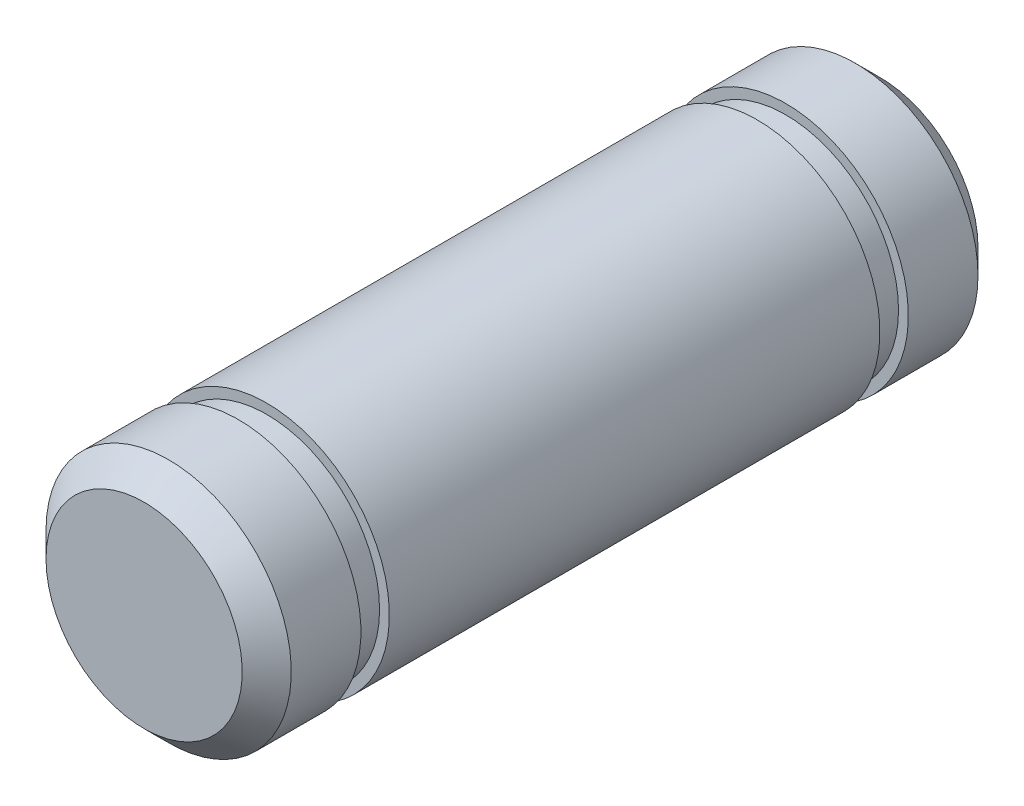
from build123d import *

# Parameters (mm, degrees)
SKETCH3_R           = 3.175
BOSS_EXTRUDE1_DEPTH = 76.2
CHAMFER1_SIZE       = 0.635
CUT_TO_LENGTH_START = -19.05
SKETCH4_R           = 3.175
CUT_TO_LENGTH_DEPTH = 134.416131485
CHAMER_CUT_END_SIZE = 0.635
SKETCH5_W           = 0.254
SKETCH5_H           = 0.7366


with BuildPart() as part:
    # Sketch3 → Boss-Extrude1 (new, symmetric)
    with BuildSketch(Plane.XY):
        with Locations(Location((0, 0, 0), (0, 0, 180))):
            Circle(SKETCH3_R)
    extrude(amount=BOSS_EXTRUDE1_DEPTH, both=True)

    # Chamfer1
    chamfer1_edges = [part.edges().sort_by_distance(p)[0] for p in [
        (3.175, 0, -76.2),
        (3.175, 0, 76.2),
    ]]
    chamfer(chamfer1_edges, length=CHAMFER1_SIZE)

    # Sketch4 → CUT-TO-LENGTH (cut, through all)
    with BuildSketch(Plane(origin=(0, 0, -76.2), x_dir=(-1, 0, 0), z_dir=(0, 0, -1)).offset(CUT_TO_LENGTH_START)):
        Circle(SKETCH4_R)
    extrude(amount=-CUT_TO_LENGTH_DEPTH, mode=Mode.SUBTRACT)

    # CHAMER-CUT-END
    chamer_cut_end_edges = [part.edges().sort_by_distance(p)[0] for p in [
        (3.175, 0, -57.15),
    ]]
    chamfer(chamer_cut_end_edges, length=CHAMER_CUT_END_SIZE)

    # Sketch5 → SNAP-RING-CUT (revolve, cut)
    with BuildSketch(Plane(origin=(0, 0, 0), x_dir=(1, 0, 0), z_dir=(0, 1, 0))):
        with Locations((3.048, 59.9567)):
            Rectangle(SKETCH5_W, SKETCH5_H)
        with Locations((3.048, 73.3933)):
            Rectangle(SKETCH5_W, SKETCH5_H)
    revolve(axis=Axis((0, 0, -57.785), (0, 0, -1)), mode=Mode.SUBTRACT)


solid = part.part
